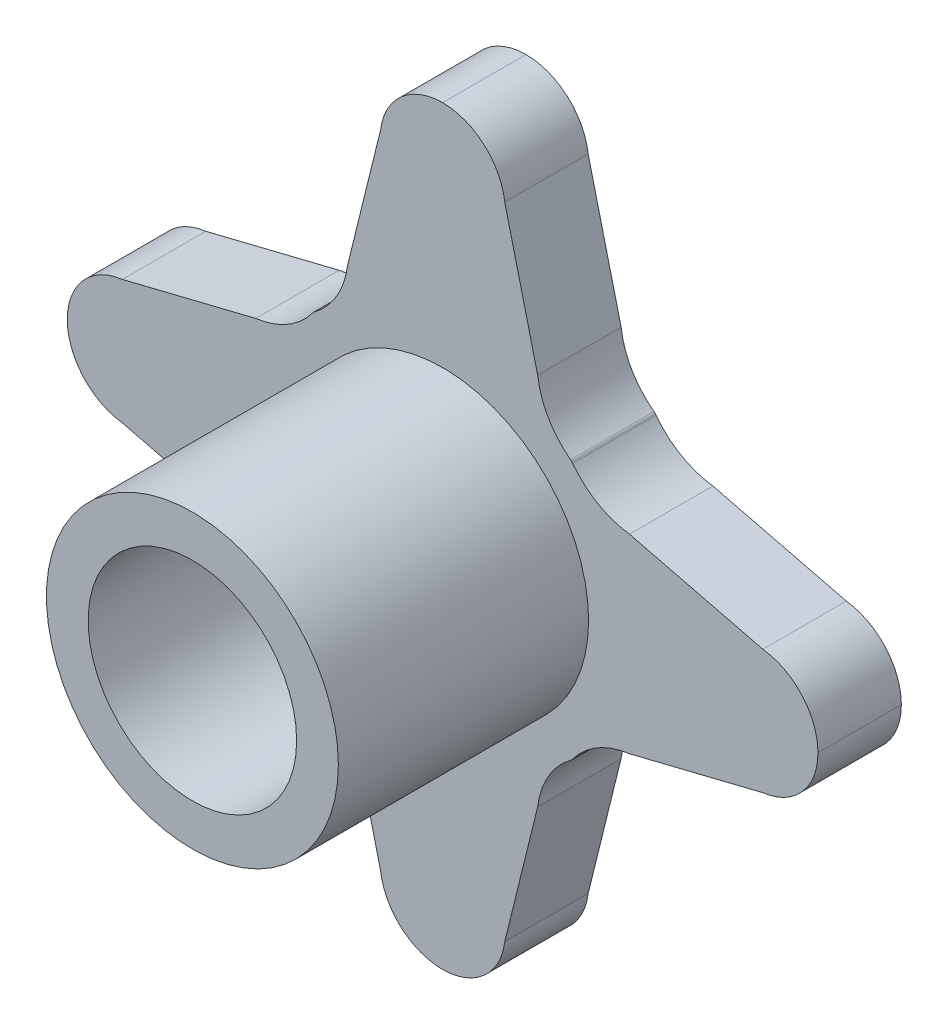
from build123d import *

# Parameters (mm, degrees)
BOSS_EXTRUDE1_DEPTH = 2
SKETCH3_R           = 3.5
SKETCH3_R_2         = 2.5
BOSS_EXTRUDE2_DEPTH = 6
SKETCH4_R           = 1.25
CUT_EXTRUDE1_DEPTH  = 1
SKETCH5_R           = 0.5
CUT_EXTRUDE2_DEPTH  = 15.525839337


with BuildPart() as part:
    # Sketch2 → Boss-Extrude1 (new body)
    with BuildSketch(Plane.XY):
        with BuildLine():
            Line((1.49, -7.68), (2.28, -4.48))
            ThreePointArc((2.28, -4.48), (2.535701974, -3.719084235), (3.07, -3.12))
            ThreePointArc((3.07, -3.12), (3.084239628, -3.109259088), (3.098353652, -3.098353652))
            ThreePointArc((3.098353652, -3.098353652), (3.109259088, -3.084239628), (3.12, -3.07))
            ThreePointArc((3.12, -3.07), (3.719084235, -2.535701974), (4.48, -2.28))
            Line((4.48, -2.28), (7.68, -1.49))
            ThreePointArc((7.68, -1.49), (8.622775638, -0.995512646), (9, 0))
            ThreePointArc((9, 0), (8.622775638, 0.995512646), (7.68, 1.49))
            Line((7.68, 1.49), (4.48, 2.28))
            ThreePointArc((4.48, 2.28), (3.719084235, 2.535701974), (3.12, 3.07))
            ThreePointArc((3.12, 3.07), (3.109259088, 3.084239628), (3.098353652, 3.098353652))
            ThreePointArc((3.098353652, 3.098353652), (3.084239628, 3.109259088), (3.07, 3.12))
            ThreePointArc((3.07, 3.12), (2.535701974, 3.719084235), (2.28, 4.48))
            Line((2.28, 4.48), (1.49, 7.68))
            ThreePointArc((1.49, 7.68), (0.995512646, 8.622775638), (0, 9))
            ThreePointArc((0, 9), (-0.995512646, 8.622775638), (-1.49, 7.68))
            Line((-1.49, 7.68), (-2.28, 4.48))
            ThreePointArc((-2.28, 4.48), (-2.535701974, 3.719084235), (-3.07, 3.12))
            ThreePointArc((-3.07, 3.12), (-3.084239628, 3.109259088), (-3.098353652, 3.098353652))
            ThreePointArc((-3.098353652, 3.098353652), (-3.109259088, 3.084239628), (-3.12, 3.07))
            ThreePointArc((-3.12, 3.07), (-3.719084235, 2.535701974), (-4.48, 2.28))
            Line((-4.48, 2.28), (-7.68, 1.49))
            ThreePointArc((-7.68, 1.49), (-8.622775638, 0.995512646), (-9, 0))
            ThreePointArc((-9, 0), (-8.622775638, -0.995512646), (-7.68, -1.49))
            Line((-7.68, -1.49), (-4.48, -2.28))
            ThreePointArc((-4.48, -2.28), (-3.719084235, -2.535701974), (-3.12, -3.07))
            ThreePointArc((-3.12, -3.07), (-3.109259088, -3.084239628), (-3.098353652, -3.098353652))
            ThreePointArc((-3.098353652, -3.098353652), (-3.084239628, -3.109259088), (-3.07, -3.12))
            ThreePointArc((-3.07, -3.12), (-2.535701974, -3.719084235), (-2.28, -4.48))
            Line((-2.28, -4.48), (-1.49, -7.68))
            ThreePointArc((-1.49, -7.68), (-0.995512646, -8.622775638), (0, -9))
            ThreePointArc((0, -9), (0.995512646, -8.622775638), (1.49, -7.68))
        make_face()
    extrude(amount=BOSS_EXTRUDE1_DEPTH)

    # Sketch3 → Boss-Extrude2 (add)
    with BuildSketch(Plane.XY.offset(2)):
        Circle(SKETCH3_R)
        Circle(SKETCH3_R_2, mode=Mode.SUBTRACT)
    extrude(amount=BOSS_EXTRUDE2_DEPTH)

    # Sketch4 → Cut-Extrude1 (cut)
    with BuildSketch(Plane(origin=(0, 0, 0), x_dir=(-1, 0, 0), z_dir=(0, 0, -1))):
        Circle(SKETCH4_R)
    extrude(amount=-CUT_EXTRUDE1_DEPTH, mode=Mode.SUBTRACT)

    # Sketch5 → Cut-Extrude2 (cut, through all)
    with BuildSketch(Plane(origin=(0, 0, 1), x_dir=(-1, 0, 0), z_dir=(0, 0, -1))):
        Circle(SKETCH5_R)
    extrude(amount=-CUT_EXTRUDE2_DEPTH, mode=Mode.SUBTRACT)


solid = part.part
